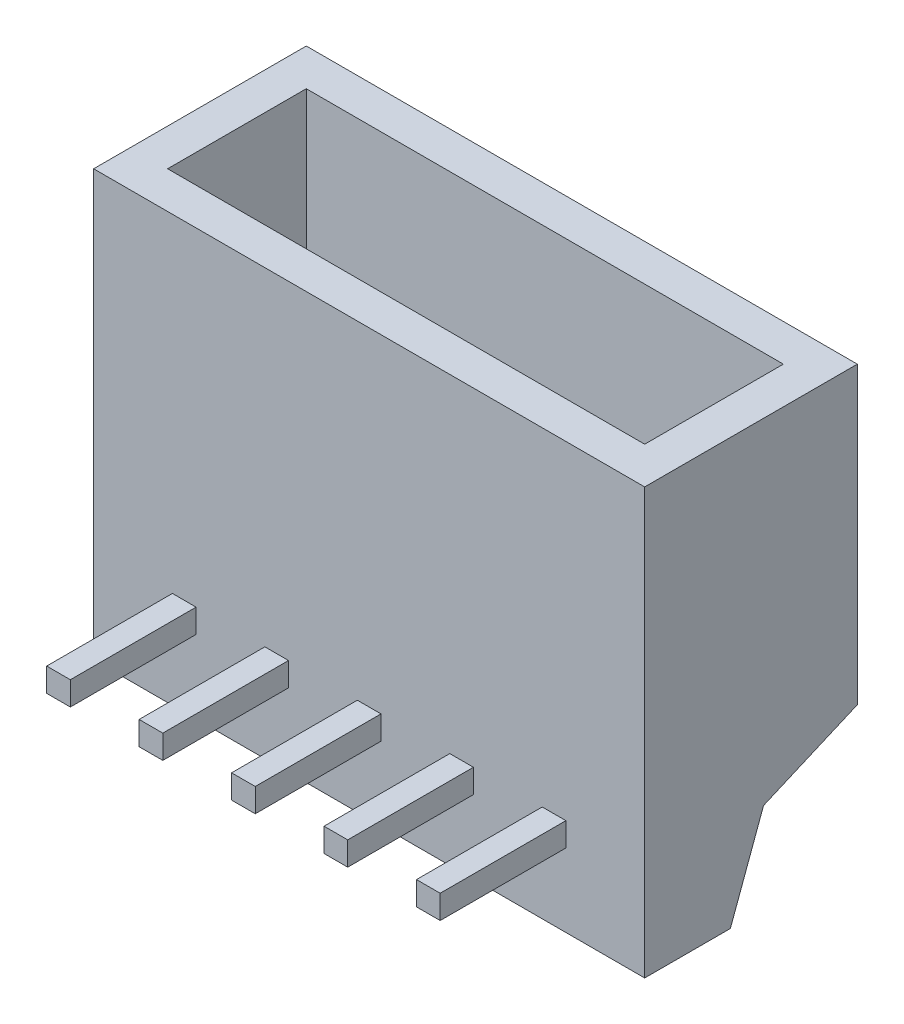
from build123d import *

# Parameters (mm, degrees)
SKETCH_1_W          = 14.9
SKETCH_1_H          = 11.5
EXTRUDE_1_DEPTH     = 5.75
SKETCH_2_W          = 0.64
SKETCH_2_H          = 0.64
EXTRUDE_2_DEPTH     = 3.4
CUT_EXTRUDE_1_DEPTH = 21.928031441
SKETCH_4_W          = 12.9
SKETCH_4_H          = 3.75
CUT_EXTRUDE_2_DEPTH = 5


with BuildPart() as part:
    # Эскиз1 → Бобышка-Вытянуть1 (new body)
    with BuildSketch(Plane.XY):
        with Locations((7.45, 5.75)):
            Rectangle(SKETCH_1_W, SKETCH_1_H)
    extrude(amount=EXTRUDE_1_DEPTH)

    # Эскиз2 → Бобышка-Вытянуть2 (add)
    with BuildSketch(Plane.XY.offset(5.75)):
        with Locations((4.95, 2.3)):
            Rectangle(SKETCH_2_W, SKETCH_2_H)
        with Locations((2.45, 2.3)):
            Rectangle(SKETCH_2_W, SKETCH_2_H)
        with Locations((7.45, 2.3)):
            Rectangle(SKETCH_2_W, SKETCH_2_H)
        with Locations((9.95, 2.3)):
            Rectangle(SKETCH_2_W, SKETCH_2_H)
        with Locations((12.45, 2.3)):
            Rectangle(SKETCH_2_W, SKETCH_2_H)
    extrude(amount=EXTRUDE_2_DEPTH)

    # Эскиз3 → Вырез-Вытянуть1 (cut, through all)
    with BuildSketch(Plane.ZY):
        Polygon((0, 0), (0, 3.523806865), (2.536361598, 2.431096681), (3.433362495, 0), align=None)
    extrude(amount=-CUT_EXTRUDE_1_DEPTH, mode=Mode.SUBTRACT)

    # Эскиз4 → Вырез-Вытянуть2 (cut)
    with BuildSketch(Plane(origin=(0, 11.5, 0), x_dir=(1, 0, 0), z_dir=(0, 1, 0))):
        with Locations((7.45, -2.875)):
            Rectangle(SKETCH_4_W, SKETCH_4_H)
    extrude(amount=-CUT_EXTRUDE_2_DEPTH, mode=Mode.SUBTRACT)


solid = part.part
